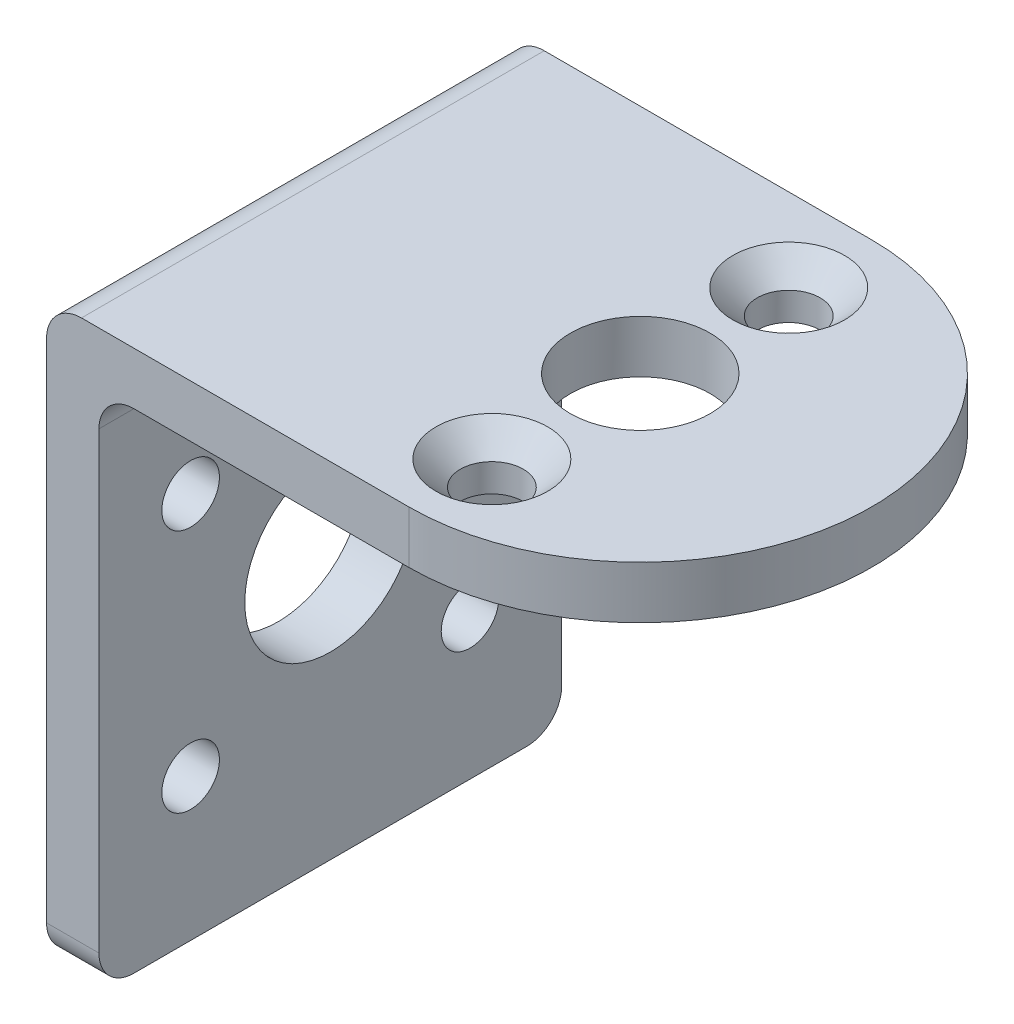
from build123d import *

# Parameters (mm, degrees)
EXTRUDE_1_DEPTH           = 13.25
CUT_EXTRUDE_2_DEPTH       = 40
SKETCH_5_R                = 1.65
SKETCH_5_R_2              = 4.9
CUT_EXTRUDE_4_DEPTH       = 40
FILLET_1_R                = 2
SKETCH_7_R                = 4
CUT_EXTRUDE_5_DEPTH       = 10
HOLE_WIZARD_1_D           = 3.6
HOLE_WIZARD_1_DEPTH       = 8
HOLE_WIZARD_1_CSINK_D     = 6.4
HOLE_WIZARD_1_CSINK_ANGLE = 90
HOLE_WIZARD_1_TIP         = 1.081549114
HOLE_WIZARD_2_D           = 3.6
HOLE_WIZARD_2_DEPTH       = 8
HOLE_WIZARD_2_CSINK_D     = 6.4
HOLE_WIZARD_2_CSINK_ANGLE = 90
HOLE_WIZARD_2_TIP         = 1.081549114


with BuildPart() as part:
    # 草图1 → 凸台-拉伸1 (new, symmetric)
    with BuildSketch(Plane.XY):
        with BuildLine():
            Line((0, -33), (0, -2))
            ThreePointArc((0, -2), (0.585786438, -0.585786438), (2, 0))
            Line((2, 0), (50, 0))
            Line((50, 0), (50, -3))
            Line((50, -3), (5, -3))
            ThreePointArc((5, -3), (3.585786438, -3.585786438), (3, -5))
            Line((3, -5), (3, -33))
            Line((3, -33), (0, -33))
        make_face()
    extrude(amount=EXTRUDE_1_DEPTH, both=True)

    # 草图3 → 切除-拉伸2 (cut)
    with BuildSketch(Plane.XZ.offset(3)):
        with BuildLine():
            Line((20.75, 13.25), (50, 13.25))
            Line((50, 13.25), (50, -13.25))
            Line((50, -13.25), (20.75, -13.25))
            ThreePointArc((20.75, -13.25), (34, 0), (20.75, 13.25))
        make_face()
    extrude(amount=-CUT_EXTRUDE_2_DEPTH, mode=Mode.SUBTRACT)

    # 草图5 → 切除-拉伸4 (cut)
    with BuildSketch(Plane.ZY):
        with Locations((8, -10.85)):
            Circle(SKETCH_5_R)
        with Locations((8, -24.85)):
            Circle(SKETCH_5_R)
        with Locations((-8, -24.85)):
            Circle(SKETCH_5_R)
        with Locations((-8, -10.85)):
            Circle(SKETCH_5_R)
        with Locations((0, -17.8)):
            Circle(SKETCH_5_R_2)
    extrude(amount=-CUT_EXTRUDE_4_DEPTH, mode=Mode.SUBTRACT)

    # 圆角1
    fillet_1_edges = [part.edges().sort_by_distance(p)[0] for p in [
        (1.5, -33, 13.25),
        (1.5, -33, -13.25),
    ]]
    fillet(fillet_1_edges, radius=FILLET_1_R)

    # 草图7 → 切除-拉伸5 (cut)
    with BuildSketch(Plane(origin=(0, 0, 0), x_dir=(1, 0, 0), z_dir=(0, 1, 0))):
        with Locations(Location((20.75, 0, 0), (0, 0, 270))):
            Circle(SKETCH_7_R)
    extrude(amount=-CUT_EXTRUDE_5_DEPTH, mode=Mode.SUBTRACT)

    # 打孔尺寸开槽半沉头螺钉的类型1
    with Locations(Plane(origin=(0, 0, 0), x_dir=(1, 0, 0), z_dir=(0, 1, 0))):
        with Locations((20.75, -8.5)):
            CounterSinkHole(HOLE_WIZARD_1_D / 2, HOLE_WIZARD_1_CSINK_D / 2, depth=HOLE_WIZARD_1_DEPTH, counter_sink_angle=HOLE_WIZARD_1_CSINK_ANGLE)
            with Locations((0, 0, -(HOLE_WIZARD_1_DEPTH + HOLE_WIZARD_1_TIP / 2))):  # 118° drill point
                Cone(0, HOLE_WIZARD_1_D / 2, HOLE_WIZARD_1_TIP, mode=Mode.SUBTRACT)

    # 打孔尺寸开槽半沉头螺钉的类型2
    with Locations(Plane(origin=(0, 0, 0), x_dir=(1, 0, 0), z_dir=(0, 1, 0))):
        with Locations((20.75, 8.5)):
            CounterSinkHole(HOLE_WIZARD_2_D / 2, HOLE_WIZARD_2_CSINK_D / 2, depth=HOLE_WIZARD_2_DEPTH, counter_sink_angle=HOLE_WIZARD_2_CSINK_ANGLE)
            with Locations((0, 0, -(HOLE_WIZARD_2_DEPTH + HOLE_WIZARD_2_TIP / 2))):  # 118° drill point
                Cone(0, HOLE_WIZARD_2_D / 2, HOLE_WIZARD_2_TIP, mode=Mode.SUBTRACT)


solid = part.part
